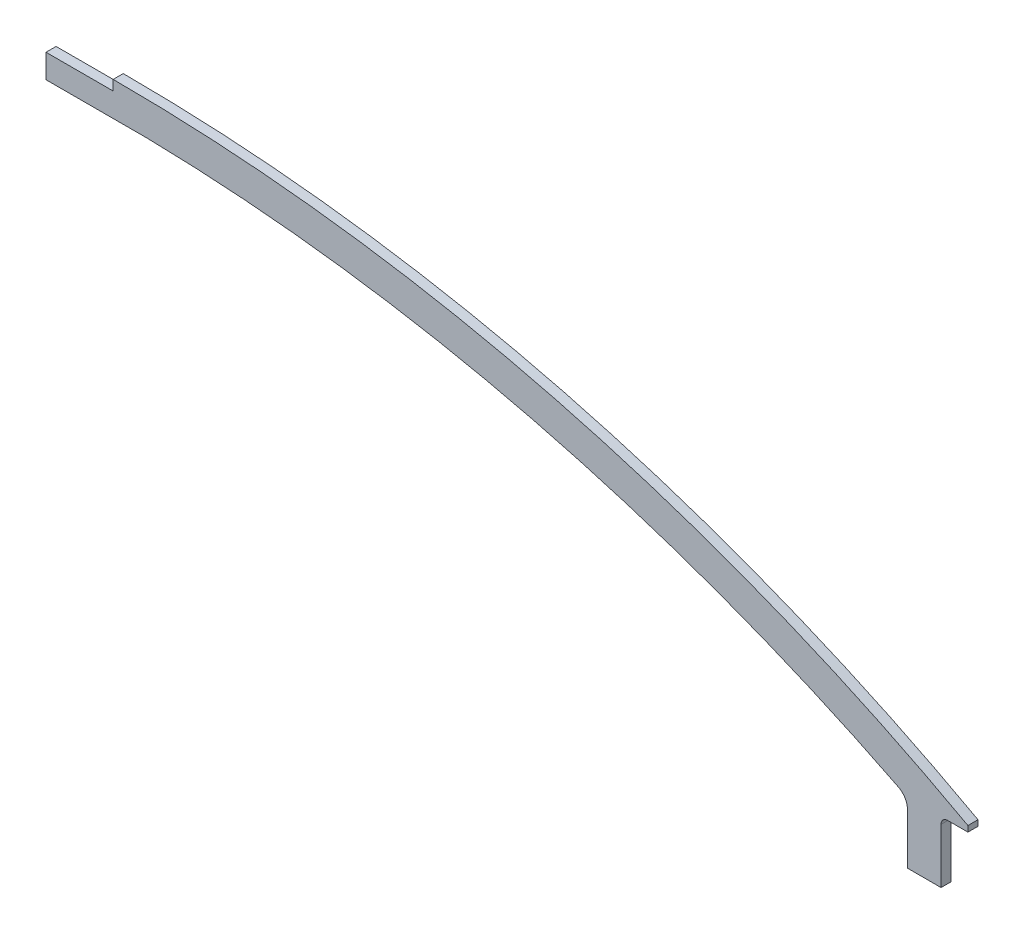
from build123d import *

# Parameters (mm, degrees)
BOSS_EXTRUDE1_DEPTH = 1.5


with BuildPart() as part:
    # Sketch2 → Boss-Extrude1 (new, symmetric)
    with BuildSketch(Plane.XY):
        with BuildLine():
            Line((299.5, -67.353443934), (293.5, -67.353443934))
            ThreePointArc((293.5, -67.353443934), (292.085786438, -67.939230372), (291.5, -69.353443934))
            Line((291.5, -69.353443934), (291.5, -85.649534053))
            Line((291.5, -85.649534053), (281.5, -85.649534053))
            Line((281.5, -85.649534053), (281.5, -70.504592149))
            ThreePointArc((281.5, -70.504592149), (280.757064897, -67.882112699), (278.749040614, -66.038966065))
            ThreePointArc((278.749040614, -66.038966065), (170.034876315, -25.766389615), (55.097618142, -10.598112953))
            ThreePointArc((55.097618142, -10.598112953), (55.000467449, -10.596696958), (54.903307584, -10.596224945))
            Line((54.903307584, -10.596224945), (25, -10.596224945))
            Line((25, -10.596224945), (25, -3.5))
            Line((25, -3.5), (45, -3.5))
            Line((45, -3.5), (45, -0.5))
            ThreePointArc((45, -0.5), (176.353256324, -17.04581533), (299.5, -65.649534053))
            Line((299.5, -65.649534053), (299.5, -67.353443934))
        make_face()
    extrude(amount=BOSS_EXTRUDE1_DEPTH, both=True)


solid = part.part
